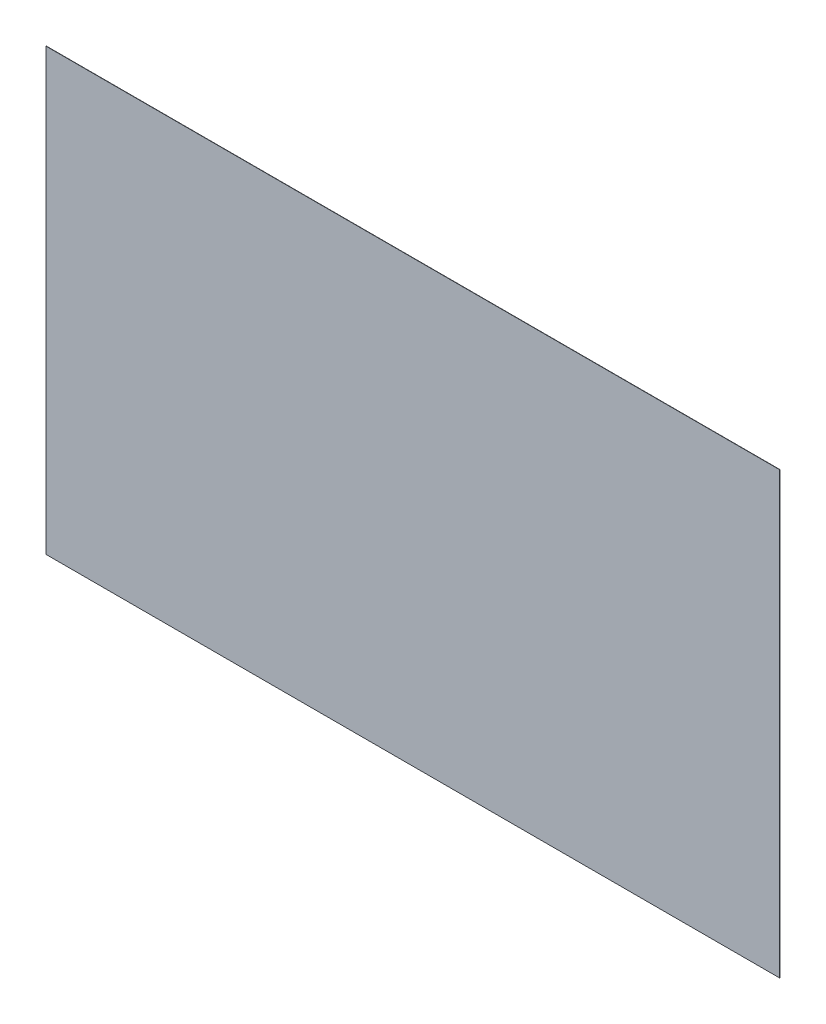
from build123d import *

# Parameters (mm, degrees)
SKETCH1_W           = 5000
SKETCH1_H           = 3000
BOSS_EXTRUDE1_DEPTH = 2


with BuildPart() as part:
    # Sketch1 → Boss-Extrude1 (new body)
    with BuildSketch(Plane.XY):
        Rectangle(SKETCH1_W, SKETCH1_H)
    extrude(amount=BOSS_EXTRUDE1_DEPTH)


solid = part.part
